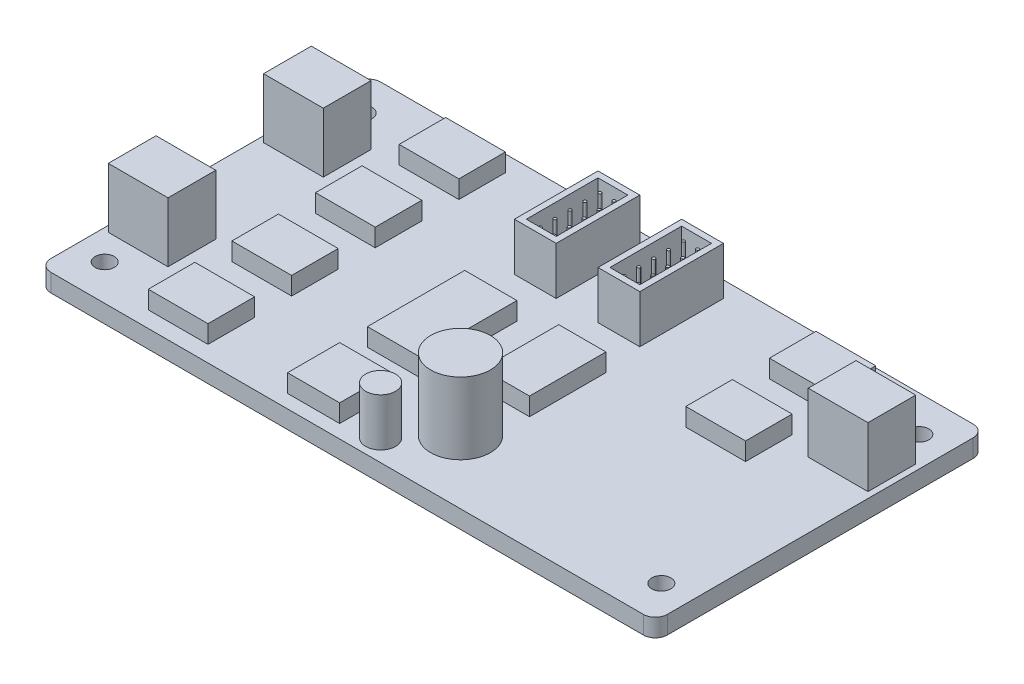
from build123d import *

# Parameters (mm, degrees)
SKETCH_1_W          = 103.2
SKETCH_1_H          = 55.2
SKETCH_1_R          = 1.6
EXTRUDE_1_DEPTH     = 3
FILLET_1_R          = 2
SKETCH_2_W          = 10
SKETCH_2_H          = 8
EXTRUDE_2_DEPTH     = 10
SKETCH_3_W          = 10
SKETCH_3_H          = 7.8
SKETCH_3_W_2        = 7.907318886
SKETCH_3_H_2        = 12.798311125
SKETCH_3_W_3        = 8.73556964
SKETCH_3_H_3        = 16.298311125
SKETCH_3_H_4        = 8.73556964
EXTRUDE_3_DEPTH     = 3
SKETCH_4_R          = 2.5
SKETCH_4_W          = 7
SKETCH_4_H          = 14
SKETCH_4_W_2        = 5
SKETCH_4_H_2        = 12
EXTRUDE_4_DEPTH     = 8
SKETCH_5_R          = 0.25
EXTRUDE_5_DEPTH     = 7
SKETCH_6_R          = 5
EXTRUDE_6_DEPTH     = 12
SKETCH_7_W          = 36.530578683
SKETCH_7_H          = 32.729234011
CUT_EXTRUDE_1_DEPTH = 60.73541663


with BuildPart() as part:
    # 草图1 → 凸台-拉伸1 (new body)
    with BuildSketch(Plane(origin=(0, 0, 0), x_dir=(1, 0, 0), z_dir=(0, 1, 0))):
        Rectangle(SKETCH_1_W, SKETCH_1_H)
        with Locations(Location((-46.6, 21.6, 0), (0, 0, 270))):
            Circle(SKETCH_1_R, mode=Mode.SUBTRACT)
        with Locations(Location((46.6, 21.6, 0), (0, 0, 270))):
            Circle(SKETCH_1_R, mode=Mode.SUBTRACT)
        with Locations(Location((46.6, -21.6, 0), (0, 0, 270))):
            Circle(SKETCH_1_R, mode=Mode.SUBTRACT)
        with Locations(Location((-46.6, -21.6, 0), (0, 0, 270))):
            Circle(SKETCH_1_R, mode=Mode.SUBTRACT)
    extrude(amount=EXTRUDE_1_DEPTH)

    # 圆角1
    fillet_1_edges = [part.edges().sort_by_distance(p)[0] for p in [
        (51.6, 1.5, 27.6),
        (-51.6, 1.5, 27.6),
        (-51.6, 1.5, -27.6),
        (51.6, 1.5, -27.6),
    ]]
    fillet(fillet_1_edges, radius=FILLET_1_R)

    # 草图2 → 凸台-拉伸2 (add)
    with BuildSketch(Plane(origin=(0, 3, 0), x_dir=(1, 0, 0), z_dir=(0, 1, 0))):
        with Locations((-45.6, 13)):
            Rectangle(SKETCH_2_W, SKETCH_2_H)
        with Locations((45.6, 13)):
            Rectangle(SKETCH_2_W, SKETCH_2_H)
        with Locations((45.6, -13)):
            Rectangle(SKETCH_2_W, SKETCH_2_H)
        with Locations((-45.6, -13)):
            Rectangle(SKETCH_2_W, SKETCH_2_H)
    extrude(amount=EXTRUDE_2_DEPTH)

    # 草图3 → 凸台-拉伸3 (add)
    with BuildSketch(Plane(origin=(0, 3, 0), x_dir=(1, 0, 0), z_dir=(0, 1, 0))):
        with Locations((31, 21)):
            Rectangle(SKETCH_3_W, SKETCH_3_H)
        with Locations((-31, 21)):
            Rectangle(SKETCH_3_W, SKETCH_3_H)
        with Locations((31, 7)):
            Rectangle(SKETCH_3_W, SKETCH_3_H)
        with Locations((31, -7)):
            Rectangle(SKETCH_3_W, SKETCH_3_H)
        with Locations((31, -21)):
            Rectangle(SKETCH_3_W, SKETCH_3_H)
        with Locations((-31, 7)):
            Rectangle(SKETCH_3_W, SKETCH_3_H)
        with Locations((-31, -7)):
            Rectangle(SKETCH_3_W, SKETCH_3_H)
        with Locations((-31, -21)):
            Rectangle(SKETCH_3_W, SKETCH_3_H)
        with Locations((7.453659443, -2.077902605)):
            Rectangle(SKETCH_3_W_2, SKETCH_3_H_2)
        with Locations((-7.86778482, -3.827902605)):
            Rectangle(SKETCH_3_W_3, SKETCH_3_H_3)
        with Locations((-7.86778482, -20.98502184)):
            Rectangle(SKETCH_3_W_3, SKETCH_3_H_4)
    extrude(amount=EXTRUDE_3_DEPTH)

    # 草图4 → 凸台-拉伸4 (add)
    # profile 1 of 3: a face of its own
    with BuildSketch(Plane(origin=(0, 3, 0), x_dir=(1, 0, 0), z_dir=(0, 1, 0))):
        with Locations(Location((2, -24, 0), (0, 0, 90))):
            Circle(SKETCH_4_R)
    # profile 2 of 3: a face of its own
    with BuildSketch(Plane(origin=(0, 3, 0), x_dir=(1, 0, 0), z_dir=(0, 1, 0))):
        with Locations((-7, 17.9)):
            Rectangle(SKETCH_4_W, SKETCH_4_H)
        with Locations((-7, 17.9)):
            Rectangle(SKETCH_4_W_2, SKETCH_4_H_2, mode=Mode.SUBTRACT)
    # profile 3 of 3: a face of its own
    with BuildSketch(Plane(origin=(0, 3, 0), x_dir=(1, 0, 0), z_dir=(0, 1, 0))):
        with Locations((7, 17.9)):
            Rectangle(SKETCH_4_W, SKETCH_4_H)
        with Locations((7, 17.9)):
            Rectangle(SKETCH_4_W_2, SKETCH_4_H_2, mode=Mode.SUBTRACT)
    extrude(amount=EXTRUDE_4_DEPTH)

    # 草图5 → 凸台-拉伸5 (add)
    with BuildSketch(Plane(origin=(0, 3, 0), x_dir=(1, 0, 0), z_dir=(0, 1, 0))):
        with Locations(Location((-8.182313365, 22.9, 0), (0, 0, 90))):
            Circle(SKETCH_5_R)
        with Locations(Location((-5.817686635, 22.9, 0), (0, 0, 90))):
            Circle(SKETCH_5_R)
        with Locations(Location((-8.182313365, 20.4, 0), (0, 0, 90))):
            Circle(SKETCH_5_R)
        with Locations(Location((-5.817686635, 20.4, 0), (0, 0, 90))):
            Circle(SKETCH_5_R)
        with Locations(Location((-8.182313365, 17.9, 0), (0, 0, 90))):
            Circle(SKETCH_5_R)
        with Locations(Location((-5.817686635, 17.9, 0), (0, 0, 90))):
            Circle(SKETCH_5_R)
        with Locations(Location((-8.182313365, 15.4, 0), (0, 0, 90))):
            Circle(SKETCH_5_R)
        with Locations(Location((-5.817686635, 15.4, 0), (0, 0, 90))):
            Circle(SKETCH_5_R)
        with Locations(Location((-8.182313365, 12.9, 0), (0, 0, 90))):
            Circle(SKETCH_5_R)
        with Locations(Location((-5.817686635, 12.9, 0), (0, 0, 90))):
            Circle(SKETCH_5_R)
        with Locations(Location((5.817686635, 12.9, 0), (0, 0, 90))):
            Circle(SKETCH_5_R)
        with Locations(Location((8.182313365, 12.9, 0), (0, 0, 90))):
            Circle(SKETCH_5_R)
        with Locations(Location((5.817686635, 15.4, 0), (0, 0, 90))):
            Circle(SKETCH_5_R)
        with Locations(Location((8.182313365, 15.4, 0), (0, 0, 90))):
            Circle(SKETCH_5_R)
        with Locations(Location((5.817686635, 17.9, 0), (0, 0, 90))):
            Circle(SKETCH_5_R)
        with Locations(Location((8.182313365, 17.9, 0), (0, 0, 90))):
            Circle(SKETCH_5_R)
        with Locations(Location((5.817686635, 20.4, 0), (0, 0, 90))):
            Circle(SKETCH_5_R)
        with Locations(Location((8.182313365, 20.4, 0), (0, 0, 90))):
            Circle(SKETCH_5_R)
        with Locations(Location((8.182313365, 22.9, 0), (0, 0, 90))):
            Circle(SKETCH_5_R)
        with Locations(Location((5.817686635, 22.9, 0), (0, 0, 90))):
            Circle(SKETCH_5_R)
    extrude(amount=EXTRUDE_5_DEPTH)

    # 草图6 → 凸台-拉伸6 (add)
    with BuildSketch(Plane(origin=(0, 3, 0), x_dir=(1, 0, 0), z_dir=(0, 1, 0))):
        with Locations(Location((8.346758727, -16.964516113, 0), (0, 0, 90))):
            Circle(SKETCH_6_R)
    extrude(amount=EXTRUDE_6_DEPTH)

    # 草图7 → 切除-拉伸1 (cut, through all)
    with BuildSketch(Plane(origin=(0, 3, 0), x_dir=(1, 0, 0), z_dir=(0, 1, 0))):
        with Locations((40.691092522, -17.246006906)):
            Rectangle(SKETCH_7_W, SKETCH_7_H)
    extrude(amount=CUT_EXTRUDE_1_DEPTH, mode=Mode.SUBTRACT)


solid = part.part
